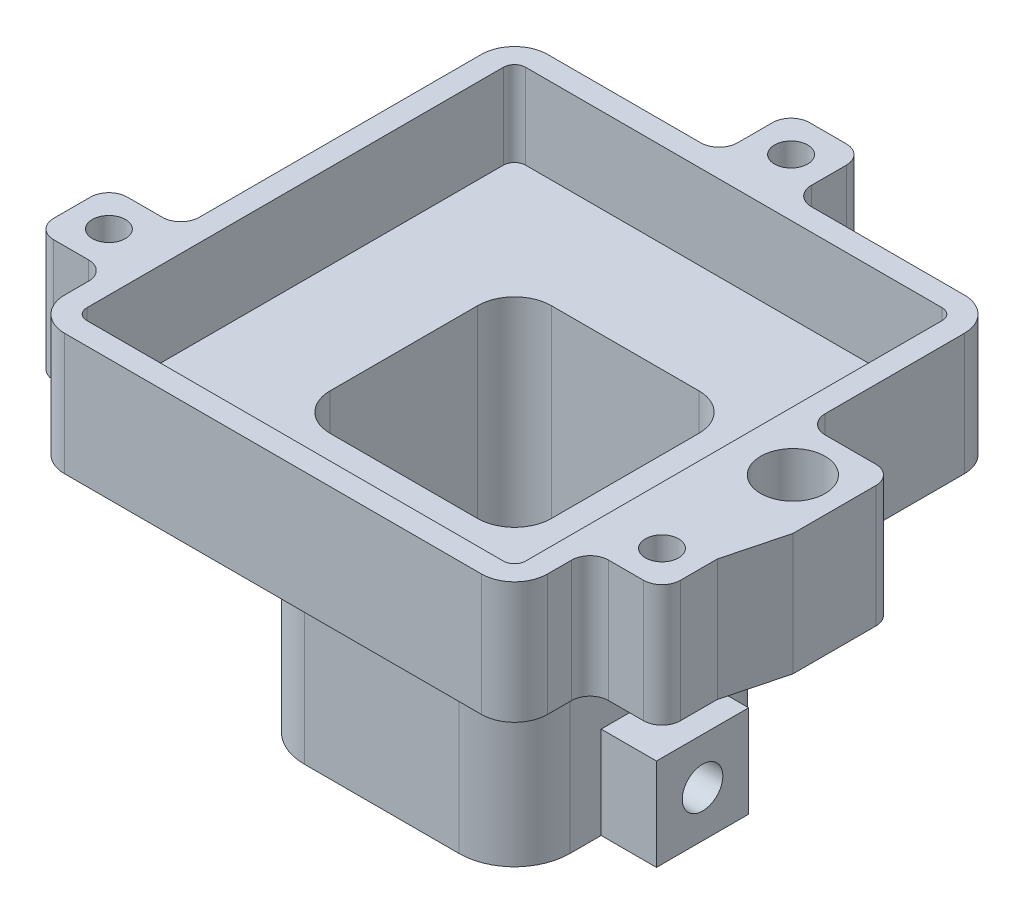
from build123d import *

# Parameters (mm, degrees)
BOSS_EXTRUDE1_DEPTH       = 2.3
BOSS_EXTRUDE2_START       = 1
BOSS_EXTRUDE2_DEPTH       = 1
SKETCH19_W                = 2
SKETCH19_H                = 1.95
SKETCH19_R                = 0.45
SKETCH19_W_2              = 1.95
SKETCH19_H_2              = 2
CMOS_MOUNTING_HOLES_DEPTH = 3.3
FILLET1_R                 = 0.5
SKETCH21_W                = 7.2
SKETCH21_H                = 7.2
SKETCH21_W_2              = 6
SKETCH21_H_2              = 6
COLUMN_DEPTH              = 6.52
SKETCH22_W                = 6
SKETCH22_H                = 6
COLUMN_EXTRUDED_CUT_DEPTH = 14.675174588
COLUMN_OUTSIDE_FILLET_R   = 1.5
COLUMN_INSIDE_FILLET_R    = 1
SKETCH25_W                = 2.5
SKETCH25_H                = 2.5
SET_SCREW_EXTRUSION_DEPTH = 1.5
SET_SCREW_HOLE_REACH      = 21.834
SKETCH26_R                = 0.55
LARGE_START               = -3.3
SKETCH29_R                = 0.875
LARGE_WIRE_HOLE_DEPTH     = 3.3
FILLET3_R                 = 0.5


with BuildPart() as part:
    # Sketch4 → Boss-Extrude1 (new body)
    with BuildSketch(Plane(origin=(0, 9.37, 0), x_dir=(1, 0, 0), z_dir=(0, 1, 0))):
        with BuildLine():
            Line((-6.55, 5.65), (-6.55, -5.65))
            ThreePointArc((-6.55, -5.65), (-6.286396103, -6.286396103), (-5.65, -6.55))
            Line((-5.65, -6.55), (5.65, -6.55))
            ThreePointArc((5.65, -6.55), (6.286396103, -6.286396103), (6.55, -5.65))
            Line((6.55, -5.65), (6.55, 5.65))
            ThreePointArc((6.55, 5.65), (6.286396103, 6.286396103), (5.65, 6.55))
            Line((5.65, 6.55), (-5.65, 6.55))
            ThreePointArc((-5.65, 6.55), (-6.286396103, 6.286396103), (-6.55, 5.65))
        make_face()
        with BuildLine():
            Line((-5.65, 5.95), (5.65, 5.95))
            ThreePointArc((5.65, 5.95), (5.862132034, 5.862132034), (5.95, 5.65))
            Line((5.95, 5.65), (5.95, -5.65))
            ThreePointArc((5.95, -5.65), (5.862132034, -5.862132034), (5.65, -5.95))
            Line((5.65, -5.95), (-5.65, -5.95))
            ThreePointArc((-5.65, -5.95), (-5.862132034, -5.862132034), (-5.95, -5.65))
            Line((-5.95, -5.65), (-5.95, 5.65))
            ThreePointArc((-5.95, 5.65), (-5.862132034, 5.862132034), (-5.65, 5.95))
        make_face(mode=Mode.SUBTRACT)
    extrude(amount=BOSS_EXTRUDE1_DEPTH)

    # Sketch20 → Boss-Extrude2 (add)
    with BuildSketch(Plane.XZ.offset(-9.37).offset(BOSS_EXTRUDE2_START)):
        with BuildLine():
            Line((5.65, -6.55), (-5.65, -6.55))
            ThreePointArc((-5.65, -6.55), (-6.286396103, -6.286396103), (-6.55, -5.65))
            Line((-6.55, -5.65), (-6.55, 5.65))
            ThreePointArc((-6.55, 5.65), (-6.286396103, 6.286396103), (-5.65, 6.55))
            Line((-5.65, 6.55), (5.65, 6.55))
            ThreePointArc((5.65, 6.55), (6.286396103, 6.286396103), (6.55, 5.65))
            Line((6.55, 5.65), (6.55, -5.65))
            ThreePointArc((6.55, -5.65), (6.286396103, -6.286396103), (5.65, -6.55))
        make_face()
    extrude(amount=-BOSS_EXTRUDE2_DEPTH)

    # Sketch19 → CMOS Mounting Holes (add)
    # profile 1 of 3: a face of its own
    with BuildSketch(Plane(origin=(0, 11.67, 0), x_dir=(1, 0, 0), z_dir=(0, 1, 0))):
        with Locations((0, 7.525)):
            Rectangle(SKETCH19_W, SKETCH19_H)
        with Locations(Location((0, 7.5, 0), (0, 0, 270))):
            Circle(SKETCH19_R, mode=Mode.SUBTRACT)
    # profile 2 of 3: a face of its own
    with BuildSketch(Plane(origin=(0, 11.67, 0), x_dir=(1, 0, 0), z_dir=(0, 1, 0))):
        with Locations((-7.525, -3.5)):
            Rectangle(SKETCH19_W_2, SKETCH19_H_2)
        with Locations(Location((-7.5, -3.5, 0), (0, 0, 270))):
            Circle(SKETCH19_R, mode=Mode.SUBTRACT)
    # profile 3 of 3: a face of its own
    with BuildSketch(Plane(origin=(0, 11.67, 0), x_dir=(1, 0, 0), z_dir=(0, 1, 0))):
        with Locations((7.525, -3.5)):
            Rectangle(SKETCH19_W_2, SKETCH19_H_2)
        with Locations(Location((7.5, -3.5, 0), (0, 0, 270))):
            Circle(SKETCH19_R, mode=Mode.SUBTRACT)
    extrude(amount=-CMOS_MOUNTING_HOLES_DEPTH)

    # Fillet1
    fillet1_edges = [part.edges().sort_by_distance(p)[0] for p in [
        (1, 10.02, -6.55),
        (-1, 10.02, -6.55),
        (-1, 10.02, -8.5),
        (1, 10.02, -8.5),
        (-6.55, 10.02, 2.5),
        (-6.55, 10.02, 4.5),
        (-8.5, 10.02, 4.5),
        (-8.5, 10.02, 2.5),
        (6.55, 10.02, 4.5),
        (6.55, 10.02, 2.5),
        (8.5, 10.02, 2.5),
        (8.5, 10.02, 4.5),
    ]]
    fillet(fillet1_edges, radius=FILLET1_R)

    # Sketch21 → Column (add)
    with BuildSketch(Plane.XZ.offset(-8.37)):
        Rectangle(SKETCH21_W, SKETCH21_H)
        Rectangle(SKETCH21_W_2, SKETCH21_H_2, mode=Mode.SUBTRACT)
    extrude(amount=COLUMN_DEPTH)

    # Sketch22 → Column Extruded Cut (cut, through all)
    with BuildSketch(Plane.XZ.offset(-8.37)):
        Rectangle(SKETCH22_W, SKETCH22_H)
    extrude(amount=-COLUMN_EXTRUDED_CUT_DEPTH, mode=Mode.SUBTRACT)

    # Column Outside Fillet
    column_outside_fillet_edges = [part.edges().sort_by_distance(p)[0] for p in [
        (-3.6, 5.11, 3.6),
        (-3.6, 5.11, -3.6),
        (3.6, 5.11, -3.6),
        (3.6, 5.11, 3.6),
    ]]
    fillet(column_outside_fillet_edges, radius=COLUMN_OUTSIDE_FILLET_R)

    # Column Inside Fillet
    column_inside_fillet_edges = [part.edges().sort_by_distance(p)[0] for p in [
        (-3, 5.61, -3),
        (3, 5.61, -3),
        (3, 5.61, 3),
        (-3, 5.61, 3),
    ]]
    fillet(column_inside_fillet_edges, radius=COLUMN_INSIDE_FILLET_R)

    # Sketch25 → Set Screw Extrusion (add)
    with BuildSketch(Plane(origin=(3.6, 0, 0), x_dir=(0, 0, -1), z_dir=(1, 0, 0))):
        with Locations((0, 3.1)):
            Rectangle(SKETCH25_W, SKETCH25_H)
    extrude(amount=SET_SCREW_EXTRUSION_DEPTH)

    # Sketch26 → Set Screw Hole (cut, up to next)
    with BuildSketch(Plane(origin=(5.1, 0, 0), x_dir=(0, 0, -1), z_dir=(1, 0, 0)), mode=Mode.PRIVATE) as set_screw_hole_sk1:
        with Locations((0, 3.1)):
            Circle(SKETCH26_R)
    set_screw_hole_tool1 = extrude(set_screw_hole_sk1.sketch, amount=-SET_SCREW_HOLE_REACH, mode=Mode.PRIVATE) & part.part
    add(set_screw_hole_tool1.solids().sort_by_distance((5.1, 3.1, 0))[0], mode=Mode.SUBTRACT)

    # Sketch29 → Large Wire Hole (add)
    with BuildSketch(Plane(origin=(0, 11.67, 0), x_dir=(1, 0, 0), z_dir=(0, 1, 0)).offset(LARGE_START)):
        with BuildLine():
            Line((6.55, -2), (6.55, 1.375))
            Line((6.55, 1.375), (8.925, 1.375))
            Line((8.925, 1.375), (8.925, -1.375))
            Line((8.925, -1.375), (8.5, -3))
            ThreePointArc((8.5, -3), (8.353553391, -2.646446609), (8, -2.5))
            Line((8, -2.5), (7.05, -2.5))
            ThreePointArc((7.05, -2.5), (6.696446609, -2.353553391), (6.55, -2))
        make_face()
        with Locations(Location((7.55, 0, 0), (0, 0, 270))):
            Circle(SKETCH29_R, mode=Mode.SUBTRACT)
    extrude(amount=LARGE_WIRE_HOLE_DEPTH)

    # Fillet3
    fillet3_edges = [part.edges().sort_by_distance(p)[0] for p in [
        (6.55, 10.02, -1.375),
        (8.925, 10.02, -1.375),
    ]]
    fillet(fillet3_edges, radius=FILLET3_R)


solid = part.part
